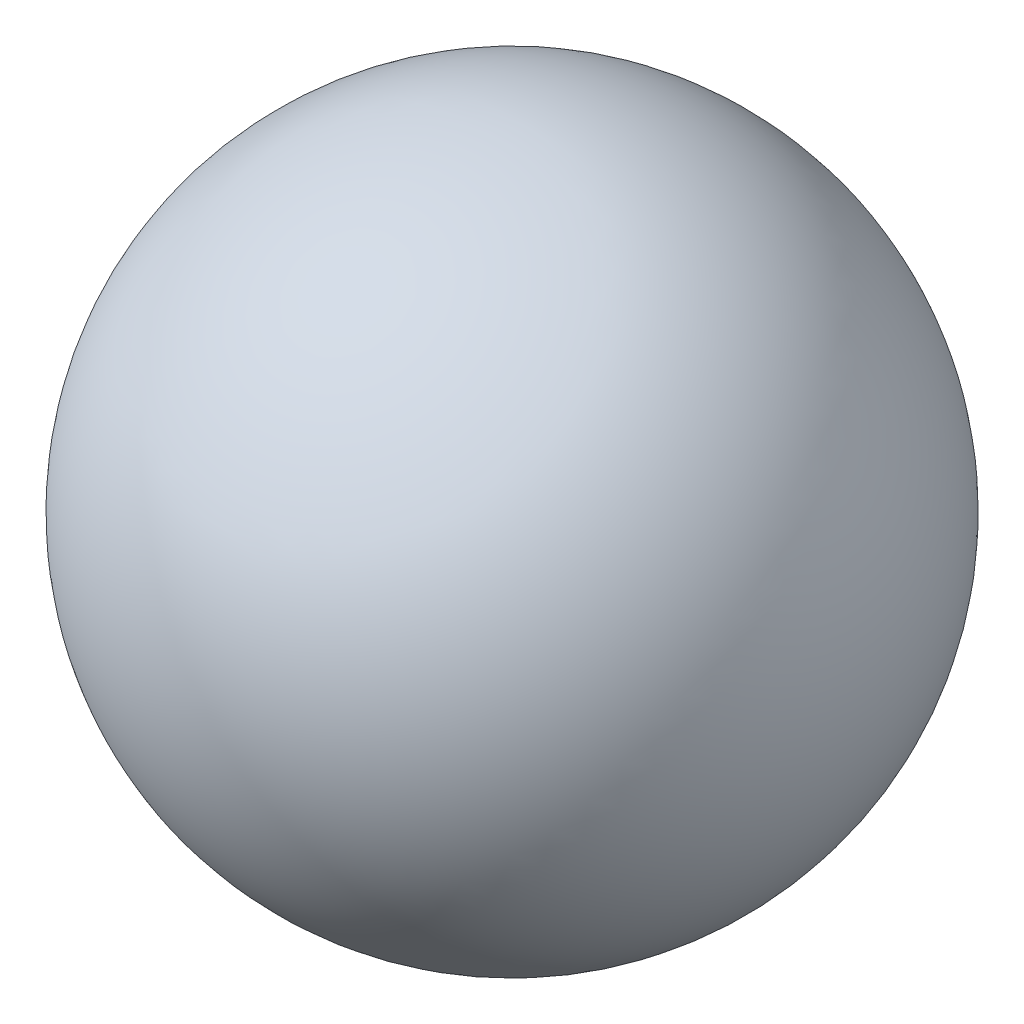
from build123d import *


with BuildPart() as part:
    # Sketch1 → Revolve1 (revolve)
    with BuildSketch(Plane(origin=(0, 0, 0), x_dir=(1, 0, 0), z_dir=(0, 1, 0))):
        with BuildLine():
            Line((0, -13.49375), (0, 13.49375))
            ThreePointArc((0, 13.49375), (13.49375, 0), (0, -13.49375))
        make_face()
    revolve(axis=Axis((0, 0, 13.49375), (0, 0, -1)))


solid = part.part
